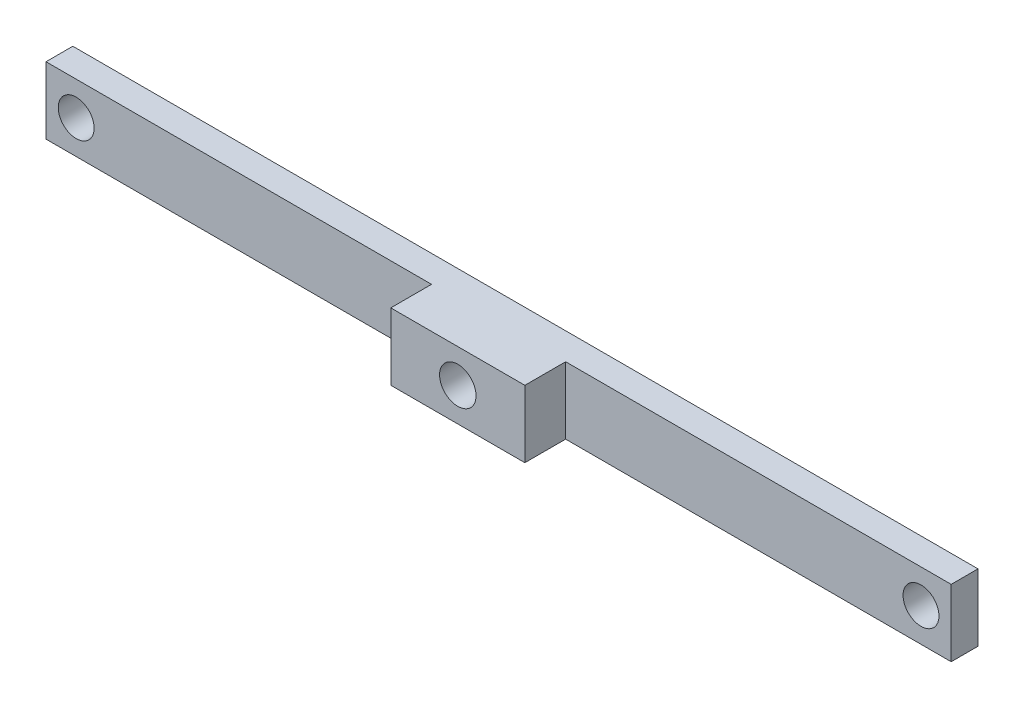
from build123d import *

# Parameters (mm, degrees)
SKETCH1_W             = 85.725
SKETCH1_H             = 6.35
BOSS_EXTRUDE1_DEPTH   = 6.40182
SKETCH2_W             = 36.5125
SKETCH2_H             = 6.35
CUT_EXTRUDE1_DEPTH    = 3.86182
M3_CLEARANCE_HOLE1_D  = 3.4
F_8_32_TAPPED_HOLE1_D = 3.4544


with BuildPart() as part:
    # Sketch1 → Boss-Extrude1 (new body)
    with BuildSketch(Plane.XY):
        Rectangle(SKETCH1_W, SKETCH1_H)
    extrude(amount=BOSS_EXTRUDE1_DEPTH)

    # Sketch2 → Cut-Extrude1 (cut)
    with BuildSketch(Plane.XY.offset(6.40182)):
        with Locations((24.60625, 0)):
            Rectangle(SKETCH2_W, SKETCH2_H)
    cut_extrude1 = extrude(amount=-CUT_EXTRUDE1_DEPTH, mode=Mode.SUBTRACT)

    # M3 Clearance Hole1 (through all)
    with Locations(Plane.XY.offset(2.54)):
        with Locations((40.005, 0)):
            m3_clearance_hole1 = Hole(M3_CLEARANCE_HOLE1_D / 2)

    # Mirror2: Cut-Extrude1, M3 Clearance Hole1 across plane
    add(cut_extrude1.mirror(Plane(origin=(0, 0, 0), x_dir=(0, 0, 1), z_dir=(1, 0, 0))), mode=Mode.SUBTRACT)
    add(m3_clearance_hole1.mirror(Plane(origin=(0, 0, 0), x_dir=(0, 0, 1), z_dir=(1, 0, 0))), mode=Mode.SUBTRACT)

    # #8-32 Tapped Hole1 (through all)
    with Locations(Plane.XY.offset(6.40182)):
        with Locations((0, 0)):
            Hole(F_8_32_TAPPED_HOLE1_D / 2)


solid = part.part
